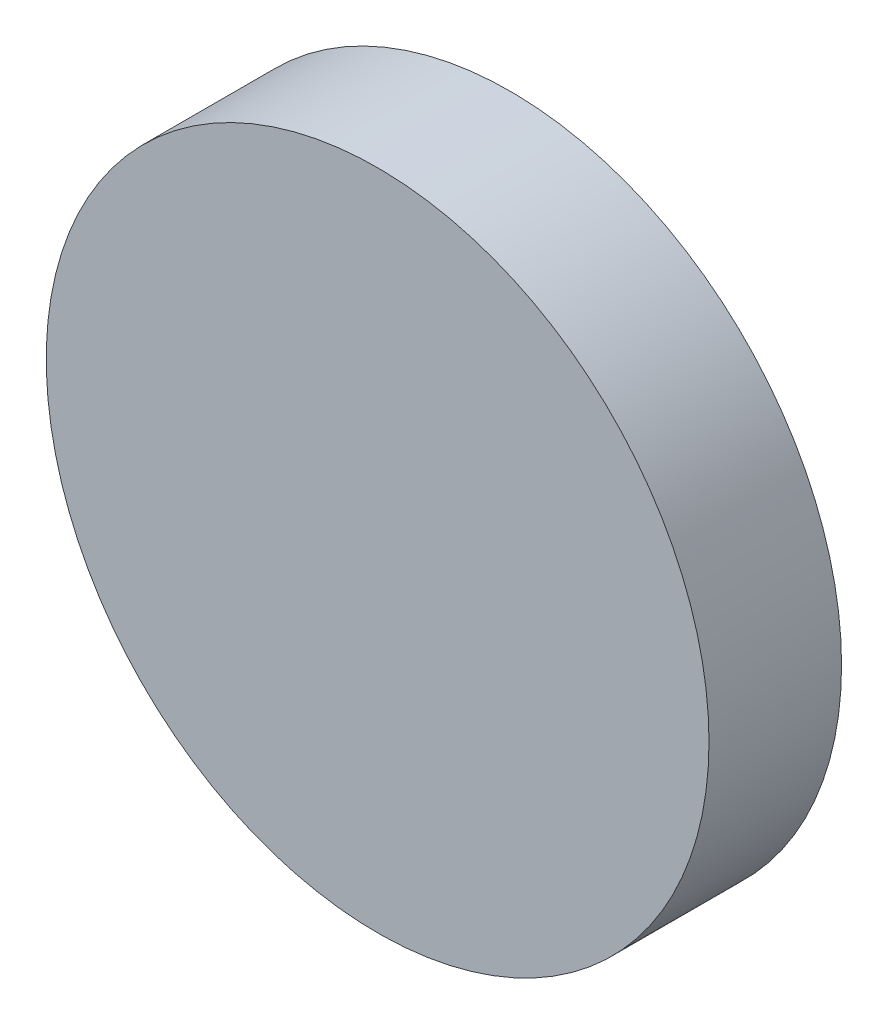
from build123d import *

# Parameters (mm, degrees)
CROQUIS1_R              = 5
SALIENTE_EXTRUIR1_DEPTH = 2


with BuildPart() as part:
    # Croquis1 → Saliente-Extruir1 (new body)
    with BuildSketch(Plane.XY):
        with Locations((-108.504553774, -77.749220728)):
            Circle(CROQUIS1_R)
    extrude(amount=SALIENTE_EXTRUIR1_DEPTH)


solid = part.part
